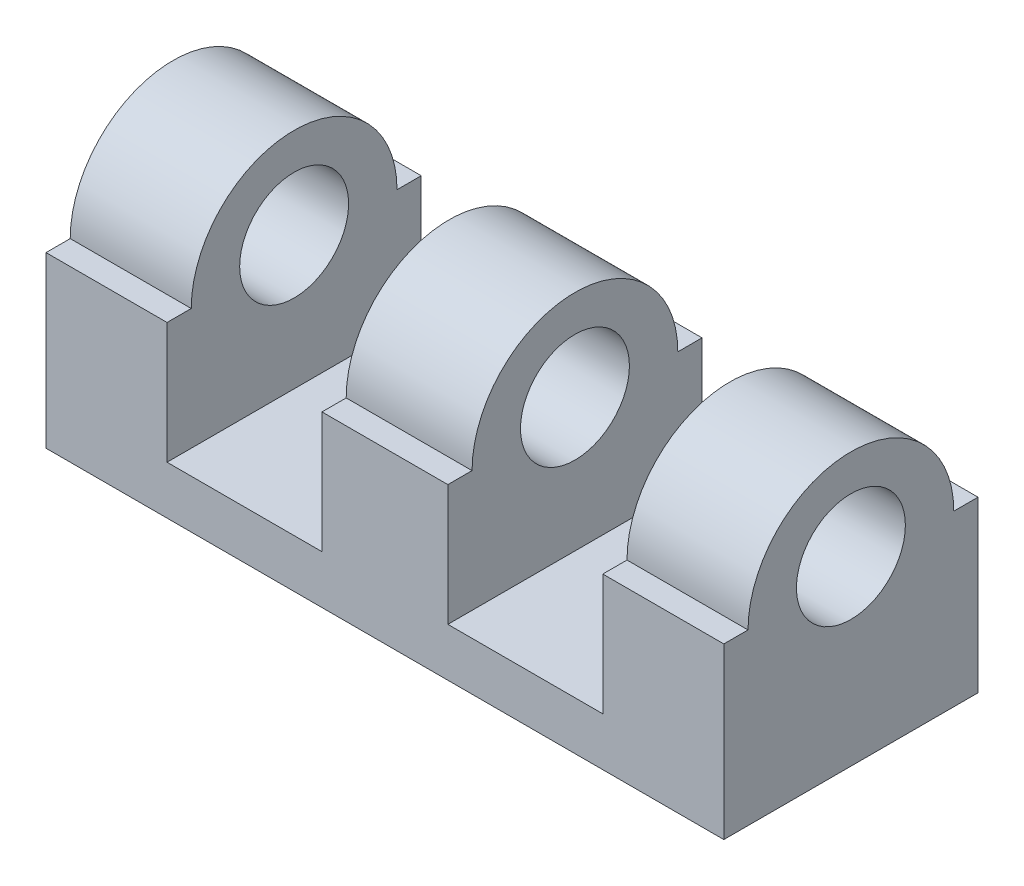
from build123d import *

# Parameters (mm, degrees)
SKETCH1_R                       = 2.25
BOSS_EXTRUDE1_DEPTH             = 14
SKETCH2_W                       = 18
SKETCH2_H                       = 9.25
CUT_EXTRUDE1_DEPTH              = 24.849790355
BOSS_EXTRUDE2_DEPTH             = 2.6
BOSS_EXTRUDE2_DEPTH_BACK        = 2.6
SKETCH4_R                       = 2.25
BOSS_EXTRUDE3_DEPTH             = 28
SKETCH7_W                       = 4.5
SKETCH7_H                       = 3
CUT_EXTRUDE2_DEPTH              = 36.082738034
SKETCH9_W                       = 28
SKETCH9_H                       = 2
BOSS_EXTRUDE4_DEPTH             = 48
BOSS_EXTRUDE5_REACH             = 60.209
SKETCH11_W                      = 28
SKETCH11_H                      = 7.313537016
BOSS_EXTRUDE5_DIRECTION_2_REACH = 60.209
SKETCH14_R                      = 2.15
CUT_EXTRUDE6_DEPTH              = 59.208886884
SKETCH15_W                      = 48
SKETCH15_H                      = 2
SKETCH15_W_2                    = 7.313537016
SKETCH15_H_2                    = 13.819983601
CUT_EXTRUDE7_DEPTH              = 64.806460469
SKETCH16_W                      = 2
SKETCH16_H                      = 7
CUT_EXTRUDE8_DEPTH              = 32.608938609


with BuildPart() as part:
    # Sketch1 → Boss-Extrude1 (new, symmetric)
    with BuildSketch(Plane(origin=(0, 0, 0), x_dir=(0, 0, -1), z_dir=(1, 0, 0))):
        with BuildLine():
            Line((2.25, 1.5), (7.25, 1.5))
            Line((7.25, 1.5), (7.25, 8.5))
            Line((7.25, 8.5), (4.25, 8.5))
            ThreePointArc((4.25, 8.5), (0, 12.75), (-4.25, 8.5))
            Line((-4.25, 8.5), (-7.25, 8.5))
            Line((-7.25, 8.5), (-7.25, 1.5))
            Line((-7.25, 1.5), (-2.25, 1.5))
            Line((-2.25, 1.5), (-2.25, -1.5))
            Line((-2.25, -1.5), (2.25, -1.5))
            Line((2.25, -1.5), (2.25, 1.5))
        make_face()
        with Locations((0, 9)):
            Circle(SKETCH1_R, mode=Mode.SUBTRACT)
    extrude(amount=BOSS_EXTRUDE1_DEPTH, both=True)

    # Sketch2 → Cut-Extrude1 (cut, through all)
    with BuildSketch(Plane.XY.offset(7.25)):
        with Locations((0, 8.125)):
            Rectangle(SKETCH2_W, SKETCH2_H)
    extrude(amount=-CUT_EXTRUDE1_DEPTH, mode=Mode.SUBTRACT)

    # Sketch4 → Boss-Extrude2 (add, two sides: drawn at the far end of the back side and taken through both)
    with BuildSketch(Plane(origin=(0, 0, 0), x_dir=(0, 0, -1), z_dir=(1, 0, 0)).offset(-BOSS_EXTRUDE2_DEPTH_BACK)):
        with BuildLine():
            Line((-4.25, 8.5), (-7.25, 8.5))
            Line((-7.25, 8.5), (-7.25, 3.5))
            Line((-7.25, 3.5), (7.25, 3.5))
            Line((7.25, 3.5), (7.25, 8.5))
            Line((7.25, 8.5), (4.25, 8.5))
            ThreePointArc((4.25, 8.5), (0, 12.75), (-4.25, 8.5))
        make_face()
        with Locations(Location((0, 9, 0), (0, 0, 180))):
            Circle(SKETCH4_R, mode=Mode.SUBTRACT)
    extrude(amount=BOSS_EXTRUDE2_DEPTH + BOSS_EXTRUDE2_DEPTH_BACK)

    # Sketch6 → Boss-Extrude3 (add, through all)
    with BuildSketch(Plane.ZY.offset(14)):
        Polygon((7.25, 8.5), (14.563537016, 15.319983601), (14.563537016, 8.319983601), (7.25, 1.5), align=None)
    extrude(amount=-BOSS_EXTRUDE3_DEPTH)

    # Sketch7 → Cut-Extrude2 (cut, through all)
    with BuildSketch(Plane.ZY.offset(14)):
        Rectangle(SKETCH7_W, SKETCH7_H)
    extrude(amount=-CUT_EXTRUDE2_DEPTH, mode=Mode.SUBTRACT)

    # Sketch9 → Boss-Extrude4 (add)
    with BuildSketch(Plane(origin=(0, 0, -7.25), x_dir=(-1, 0, 0), z_dir=(0, 0, -1))):
        with Locations((0, 2.5)):
            Rectangle(SKETCH9_W, SKETCH9_H)
    extrude(amount=BOSS_EXTRUDE4_DEPTH)

    # Boss-Extrude5: up to this face of the body (flat: up to its plane)
    boss_extrude5_end = Plane(part.part.faces().sort_by_distance((0, 1.5, -24))[0])
    # Sketch11 → Boss-Extrude5 (add, up to the picked face)
    with BuildSketch(Plane(origin=(0, 3.5, 0), x_dir=(1, 0, 0), z_dir=(0, 1, 0)), mode=Mode.PRIVATE) as boss_extrude5_sk1:
        with Locations((0, -10.906768508)):
            Rectangle(SKETCH11_W, SKETCH11_H)
    boss_extrude5_tool1 = split(extrude(boss_extrude5_sk1.sketch, amount=-BOSS_EXTRUDE5_REACH, mode=Mode.PRIVATE), bisect_by=boss_extrude5_end, keep=Keep.BOTH, mode=Mode.PRIVATE)
    add(boss_extrude5_tool1.solids().sort_by(Axis((0, 3.5, 10.906769), (0, -1, 0)))[0])

    # Boss-Extrude5 direction 2: up to this face of the body (flat: up to its plane)
    boss_extrude5_direction_2_end = Plane(part.part.faces().sort_by_distance((0, 4.9099918, 10.906768508))[0])
    # Sketch11 → Boss-Extrude5 direction 2 (add, up to the picked face)
    with BuildSketch(Plane(origin=(0, 3.5, 0), x_dir=(1, 0, 0), z_dir=(0, 1, 0)), mode=Mode.PRIVATE) as boss_extrude5_direction_2_sk1:
        with Locations((0, -10.906768508)):
            Rectangle(SKETCH11_W, SKETCH11_H)
    boss_extrude5_direction_2_tool1 = split(extrude(boss_extrude5_direction_2_sk1.sketch, amount=BOSS_EXTRUDE5_DIRECTION_2_REACH, mode=Mode.PRIVATE), bisect_by=boss_extrude5_direction_2_end, keep=Keep.BOTH, mode=Mode.PRIVATE)
    add(boss_extrude5_direction_2_tool1.solids().sort_by(Axis((0, 3.5, 10.906769), (0, 1, 0)))[0])

    # Sketch14 → Cut-Extrude6 (cut, through all)
    with BuildSketch(Plane(origin=(0, 3.5, 0), x_dir=(1, 0, 0), z_dir=(0, 1, 0))):
        with Locations(Location((11, 51, 0), (0, 0, 270))):
            Circle(SKETCH14_R)
        with Locations(Location((11, 29, 0), (0, 0, 270))):
            Circle(SKETCH14_R)
        with Locations(Location((-11, 29, 0), (0, 0, 270))):
            Circle(SKETCH14_R)
        with Locations(Location((-11, 51, 0), (0, 0, 270))):
            Circle(SKETCH14_R)
    extrude(amount=-CUT_EXTRUDE6_DEPTH, mode=Mode.SUBTRACT)

    # Sketch15 → Cut-Extrude7 (cut, through all)
    with BuildSketch(Plane.ZY.offset(14)):
        with Locations((-31.25, 2.5)):
            Rectangle(SKETCH15_W, SKETCH15_H)
        with Locations((10.906768508, 8.409991801)):
            Rectangle(SKETCH15_W_2, SKETCH15_H_2)
    extrude(amount=-CUT_EXTRUDE7_DEPTH, mode=Mode.SUBTRACT)

    # Sketch16 → Cut-Extrude8 (cut, through all)
    with BuildSketch(Plane.ZY.offset(14)):
        with Locations((-6.25, 5)):
            Rectangle(SKETCH16_W, SKETCH16_H)
        with Locations((6.25, 5)):
            Rectangle(SKETCH16_W, SKETCH16_H)
    extrude(amount=-CUT_EXTRUDE8_DEPTH, mode=Mode.SUBTRACT)


solid = part.part
